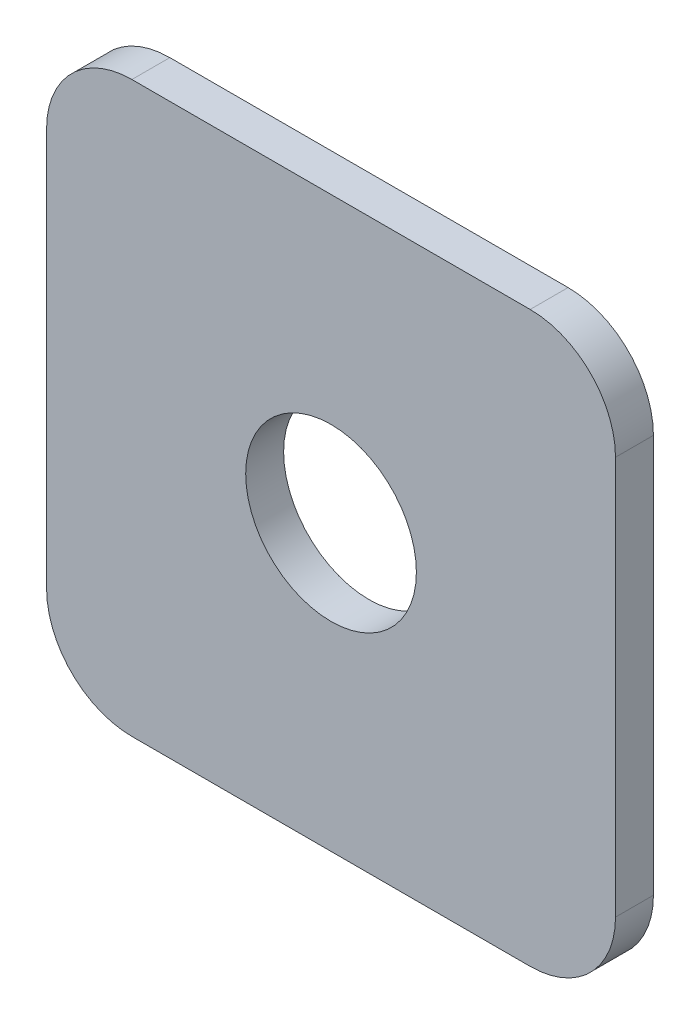
from build123d import *

# Parameters (mm, degrees)
ESQUISSE1_W        = 150
ESQUISSE1_H        = 150
ESQUISSE1_R        = 22.5
BOSS_EXTRU_1_DEPTH = 10
CONG_1_R           = 22.5


with BuildPart() as part:
    # Esquisse1 → Boss.-Extru.1 (new body)
    with BuildSketch(Plane.XY):
        with Locations((75, 75)):
            Rectangle(ESQUISSE1_W, ESQUISSE1_H)
        with Locations((75, 75)):
            Circle(ESQUISSE1_R, mode=Mode.SUBTRACT)
    extrude(amount=BOSS_EXTRU_1_DEPTH)

    # Congé1
    cong_1_edges = [part.edges().sort_by_distance(p)[0] for p in [
        (0, 150, 5),
        (150, 150, 5),
        (150, 0, 5),
        (0, 0, 5),
    ]]
    fillet(cong_1_edges, radius=CONG_1_R)


solid = part.part
